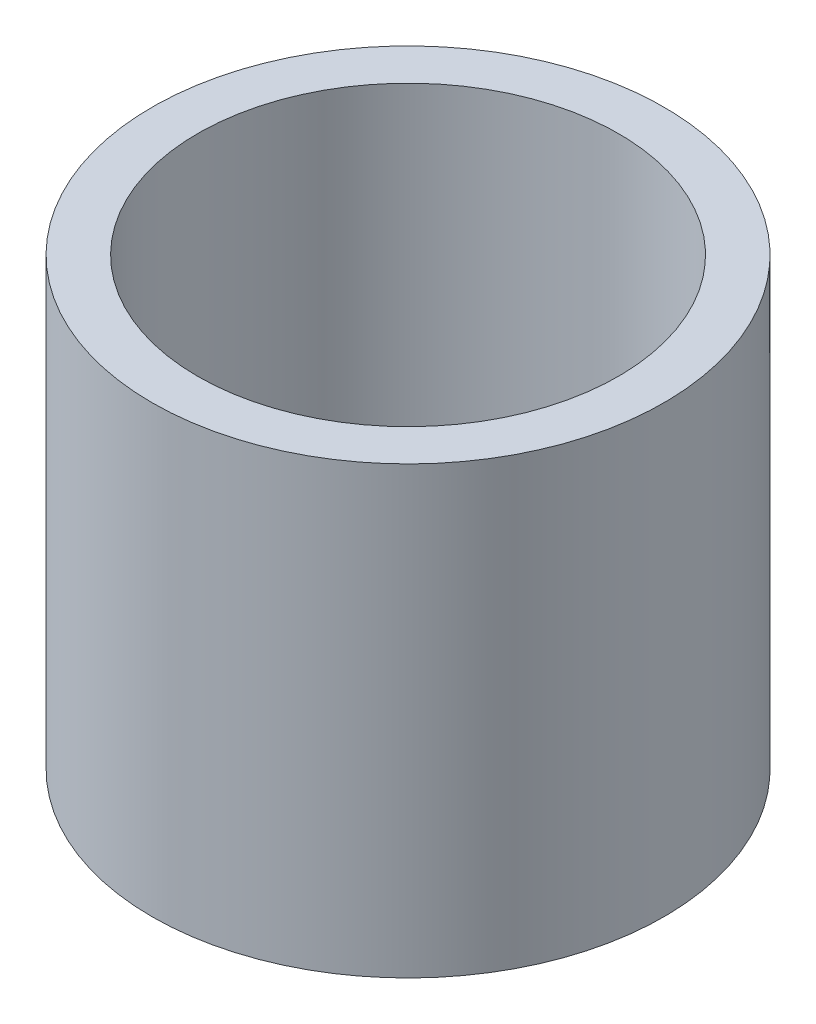
from build123d import *

# Parameters (mm, degrees)
SKETCH_1_R          = 11.5
EXTRUDE_1_DEPTH     = 20
SKETCH_2_R          = 9.45
CUT_EXTRUDE_1_DEPTH = 26.777897509


with BuildPart() as part:
    # ｽｹｯﾁ1 → ﾎﾞｽ - 押し出し1 (new body)
    with BuildSketch(Plane(origin=(0, 0, 0), x_dir=(1, 0, 0), z_dir=(0, 1, 0))):
        with Locations(Location((0, 0, 0), (0, 0, 270))):
            Circle(SKETCH_1_R)
    extrude(amount=EXTRUDE_1_DEPTH)

    # ｽｹｯﾁ2 → ｶｯﾄ - 押し出し1 (cut, through all)
    with BuildSketch(Plane(origin=(0, 20, 0), x_dir=(1, 0, 0), z_dir=(0, 1, 0))):
        with Locations(Location((0, 0, 0), (0, 0, 270))):
            Circle(SKETCH_2_R)
    extrude(amount=-CUT_EXTRUDE_1_DEPTH, mode=Mode.SUBTRACT)


solid = part.part
